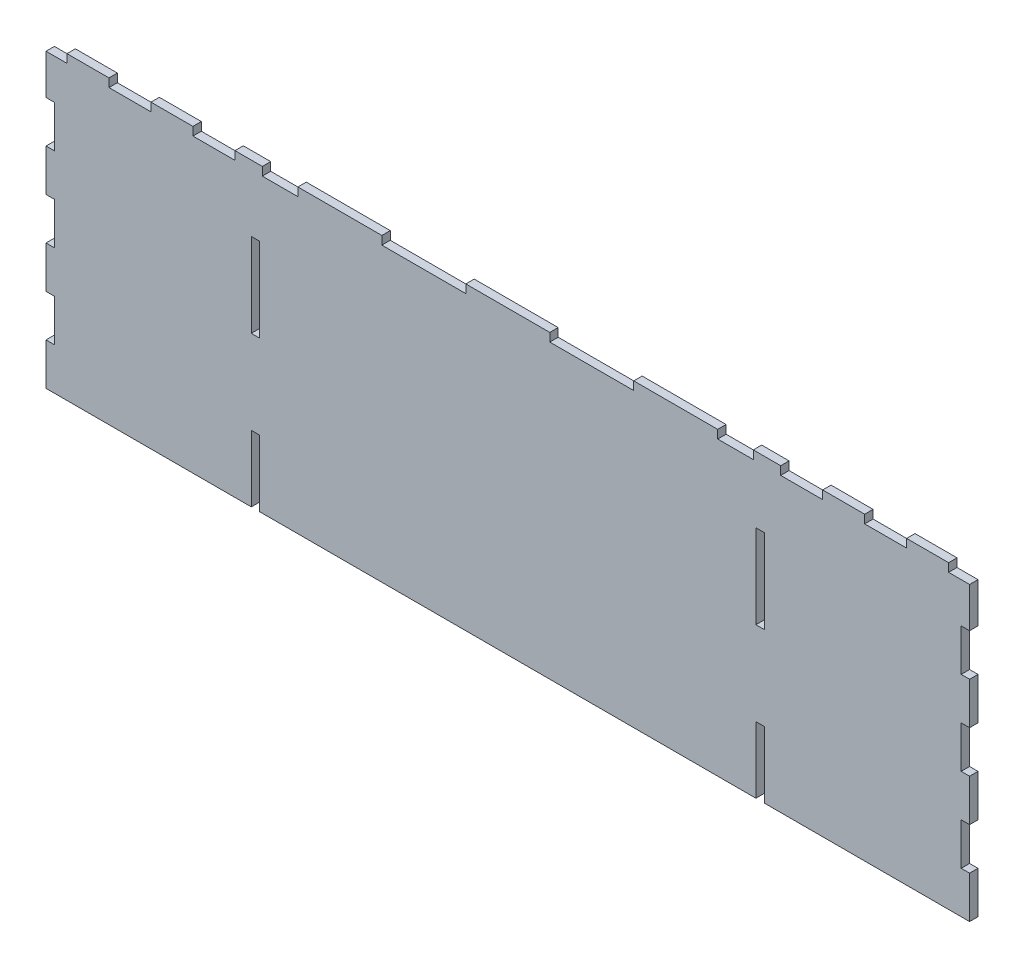
from build123d import *

# Parameters (mm, degrees)
SKETCH1_W               = 279.4
SKETCH1_H               = 90.8685
BOSS_EXTRUDE1_DEPTH     = 2.54
SKETCH2_W               = 12.7
SKETCH2_H               = 2.54
CUT_EXTRUDE1_DEPTH      = 147.92451352
LPATTERN1_COUNT         = 3
LPATTERN1_PITCH         = 25.4
MIRROR1_COPY_1_SKETCH_W = 12.7
MIRROR1_COPY_1_SKETCH_H = 2.54
MIRROR1_COPY_1_DEPTH    = 147.92451352
MIRROR1_COPY_2_SKETCH_W = 12.7
MIRROR1_COPY_2_SKETCH_H = 2.54
MIRROR1_COPY_2_DEPTH    = 147.92451352
SKETCH3_W               = 2.54
SKETCH3_H               = 25.4
CUT_EXTRUDE2_DEPTH      = 147.92451352
LPATTERN2_COUNT         = 2
LPATTERN2_PITCH         = 50.8
MIRROR2_COPY_1_SKETCH_W = 2.54
MIRROR2_COPY_1_SKETCH_H = 25.4
MIRROR2_COPY_1_DEPTH    = 147.92451352
SKETCH4_W               = 2.54
SKETCH4_H               = 12.7
CUT_EXTRUDE3_DEPTH      = 147.92451352
LPATTERN3_COUNT         = 3
LPATTERN3_PITCH         = 25.4
MIRROR3_COPY_1_SKETCH_W = 2.54
MIRROR3_COPY_1_SKETCH_H = 12.7
MIRROR3_COPY_1_DEPTH    = 147.92451352
MIRROR3_COPY_2_SKETCH_W = 2.54
MIRROR3_COPY_2_SKETCH_H = 12.7
MIRROR3_COPY_2_DEPTH    = 147.92451352
SKETCH5_W               = 25.4
SKETCH5_H               = 2.54
SKETCH5_W_2             = 10.76325
CUT_EXTRUDE4_DEPTH      = 147.92451352


with BuildPart() as part:
    # Sketch1 → Boss-Extrude1 (new body)
    with BuildSketch(Plane.XY):
        Rectangle(SKETCH1_W, SKETCH1_H)
    extrude(amount=BOSS_EXTRUDE1_DEPTH)

    # Sketch2 → Cut-Extrude1 (cut, through all)
    with BuildSketch(Plane.XY.offset(2.54)):
        with Locations((139.7, 44.16425)):
            Rectangle(SKETCH2_W, SKETCH2_H)
    cut_extrude1 = extrude(amount=-CUT_EXTRUDE1_DEPTH, mode=Mode.SUBTRACT)

    # LPattern1: Cut-Extrude1 ×3
    with Locations(*[(-i * LPATTERN1_PITCH, 0, 0) for i in range(1, LPATTERN1_COUNT)]):
        add(cut_extrude1, mode=Mode.SUBTRACT)

    # Mirror1: Cut-Extrude1 across plane
    add(cut_extrude1.mirror(Plane(origin=(0, 0, 0), x_dir=(0, 0, 1), z_dir=(1, 0, 0))), mode=Mode.SUBTRACT)

    # Mirror1 copy 1 sketch → Mirror1 copy 1 (cut, through all)
    with BuildSketch(Plane(origin=(25.4, 0, 2.54), x_dir=(-1, 0, 0), z_dir=(0, 0, 1))):
        with Locations((139.7, -44.16425)):
            Rectangle(MIRROR1_COPY_1_SKETCH_W, MIRROR1_COPY_1_SKETCH_H)
    extrude(amount=-MIRROR1_COPY_1_DEPTH, mode=Mode.SUBTRACT)

    # Mirror1 copy 2 sketch → Mirror1 copy 2 (cut, through all)
    with BuildSketch(Plane(origin=(50.8, 0, 2.54), x_dir=(-1, 0, 0), z_dir=(0, 0, 1))):
        with Locations((139.7, -44.16425)):
            Rectangle(MIRROR1_COPY_2_SKETCH_W, MIRROR1_COPY_2_SKETCH_H)
    extrude(amount=-MIRROR1_COPY_2_DEPTH, mode=Mode.SUBTRACT)

    # Sketch3 → Cut-Extrude2 (cut, through all)
    with BuildSketch(Plane.XY.offset(2.54)):
        with Locations((76.327, -38.06825)):
            Rectangle(SKETCH3_W, SKETCH3_H)
    cut_extrude2 = extrude(amount=-CUT_EXTRUDE2_DEPTH, mode=Mode.SUBTRACT)

    # LPattern2: Cut-Extrude2 ×2
    with Locations(*[(0, i * LPATTERN2_PITCH, 0) for i in range(1, LPATTERN2_COUNT)]):
        add(cut_extrude2, mode=Mode.SUBTRACT)

    # Mirror2: Cut-Extrude2 across plane
    add(cut_extrude2.mirror(Plane(origin=(0, 0, 0), x_dir=(0, 0, 1), z_dir=(1, 0, 0))), mode=Mode.SUBTRACT)

    # Mirror2 copy 1 sketch → Mirror2 copy 1 (cut, through all)
    with BuildSketch(Plane(origin=(0, 50.8, 2.54), x_dir=(-1, 0, 0), z_dir=(0, 0, 1))):
        with Locations((76.327, 38.06825)):
            Rectangle(MIRROR2_COPY_1_SKETCH_W, MIRROR2_COPY_1_SKETCH_H)
    extrude(amount=-MIRROR2_COPY_1_DEPTH, mode=Mode.SUBTRACT)

    # Sketch4 → Cut-Extrude3 (cut, through all)
    with BuildSketch(Plane.XY.offset(2.54)):
        with Locations((138.43, -26.38425)):
            Rectangle(SKETCH4_W, SKETCH4_H)
    cut_extrude3 = extrude(amount=-CUT_EXTRUDE3_DEPTH, mode=Mode.SUBTRACT)

    # LPattern3: Cut-Extrude3 ×3
    with Locations(*[(0, i * LPATTERN3_PITCH, 0) for i in range(1, LPATTERN3_COUNT)]):
        add(cut_extrude3, mode=Mode.SUBTRACT)

    # Mirror3: Cut-Extrude3 across plane
    add(cut_extrude3.mirror(Plane(origin=(0, 0, 0), x_dir=(0, 0, 1), z_dir=(1, 0, 0))), mode=Mode.SUBTRACT)

    # Mirror3 copy 1 sketch → Mirror3 copy 1 (cut, through all)
    with BuildSketch(Plane(origin=(0, 25.4, 2.54), x_dir=(-1, 0, 0), z_dir=(0, 0, 1))):
        with Locations((138.43, 26.38425)):
            Rectangle(MIRROR3_COPY_1_SKETCH_W, MIRROR3_COPY_1_SKETCH_H)
    extrude(amount=-MIRROR3_COPY_1_DEPTH, mode=Mode.SUBTRACT)

    # Mirror3 copy 2 sketch → Mirror3 copy 2 (cut, through all)
    with BuildSketch(Plane(origin=(0, 50.8, 2.54), x_dir=(-1, 0, 0), z_dir=(0, 0, 1))):
        with Locations((138.43, 26.38425)):
            Rectangle(MIRROR3_COPY_2_SKETCH_W, MIRROR3_COPY_2_SKETCH_H)
    extrude(amount=-MIRROR3_COPY_2_DEPTH, mode=Mode.SUBTRACT)

    # Sketch5 → Cut-Extrude4 (cut, through all)
    with BuildSketch(Plane.XY.offset(2.54)):
        with Locations((-25.4, 44.16425)):
            Rectangle(SKETCH5_W, SKETCH5_H)
        with Locations((-68.881625, 44.16425)):
            Rectangle(SKETCH5_W_2, SKETCH5_H)
    cut_extrude4 = extrude(amount=-CUT_EXTRUDE4_DEPTH, mode=Mode.SUBTRACT)

    # Mirror4: Cut-Extrude4 across plane
    add(cut_extrude4.mirror(Plane(origin=(0, 0, 0), x_dir=(0, 0, 1), z_dir=(1, 0, 0))), mode=Mode.SUBTRACT)


solid = part.part
